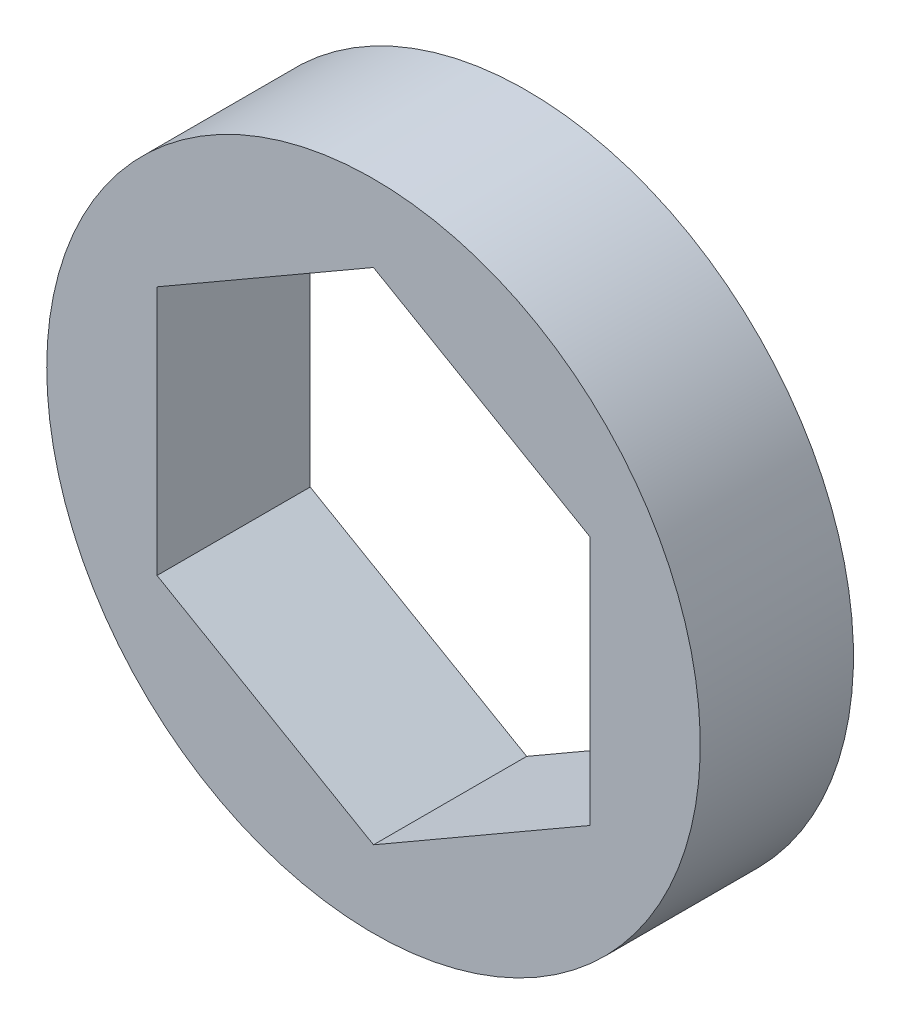
from build123d import *

# Parameters (mm, degrees)
SKETCH1_R           = 10.16
BOSS_EXTRUDE1_DEPTH = 2.38125


with BuildPart() as part:
    # Sketch1 → Boss-Extrude1 (new, symmetric)
    with BuildSketch(Plane.XY):
        with Locations(Location((0, 0, 0), (0, 0, 180))):
            Circle(SKETCH1_R)
        Polygon((0, 7.772289324), (-6.731, 3.886144662), (-6.731, -3.886144662), (0, -7.772289324), (6.731, -3.886144662), (6.731, 3.886144662), align=None, mode=Mode.SUBTRACT)
    extrude(amount=BOSS_EXTRUDE1_DEPTH, both=True)


solid = part.part
